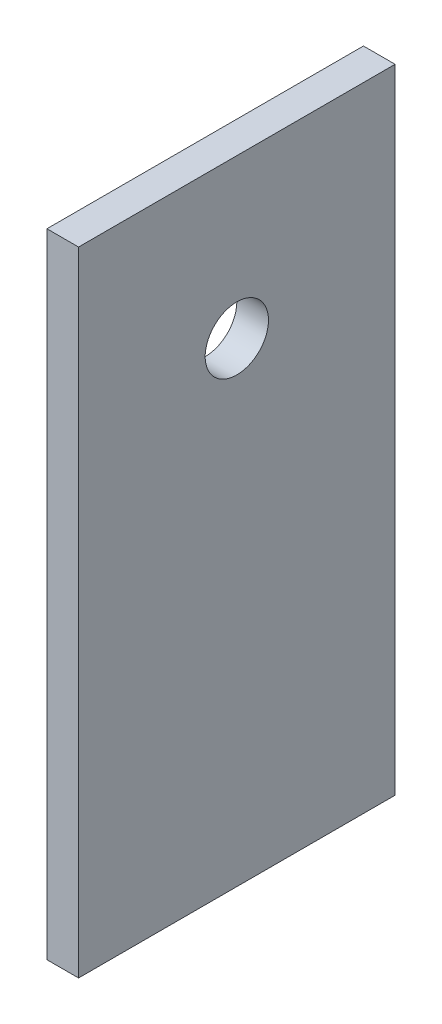
from build123d import *

# Parameters (mm, degrees)
SKETCH1_W           = 40
SKETCH1_H           = 80
SKETCH1_R           = 4
BOSS_EXTRUDE1_DEPTH = 4


with BuildPart() as part:
    # Sketch1 → Boss-Extrude1 (new body)
    with BuildSketch(Plane(origin=(0, 0, 0), x_dir=(0, 0, -1), z_dir=(1, 0, 0))):
        with Locations((0, -82.5)):
            Rectangle(SKETCH1_W, SKETCH1_H)
        with Locations((0, -62.5)):
            Circle(SKETCH1_R, mode=Mode.SUBTRACT)
    extrude(amount=BOSS_EXTRUDE1_DEPTH)


solid = part.part
